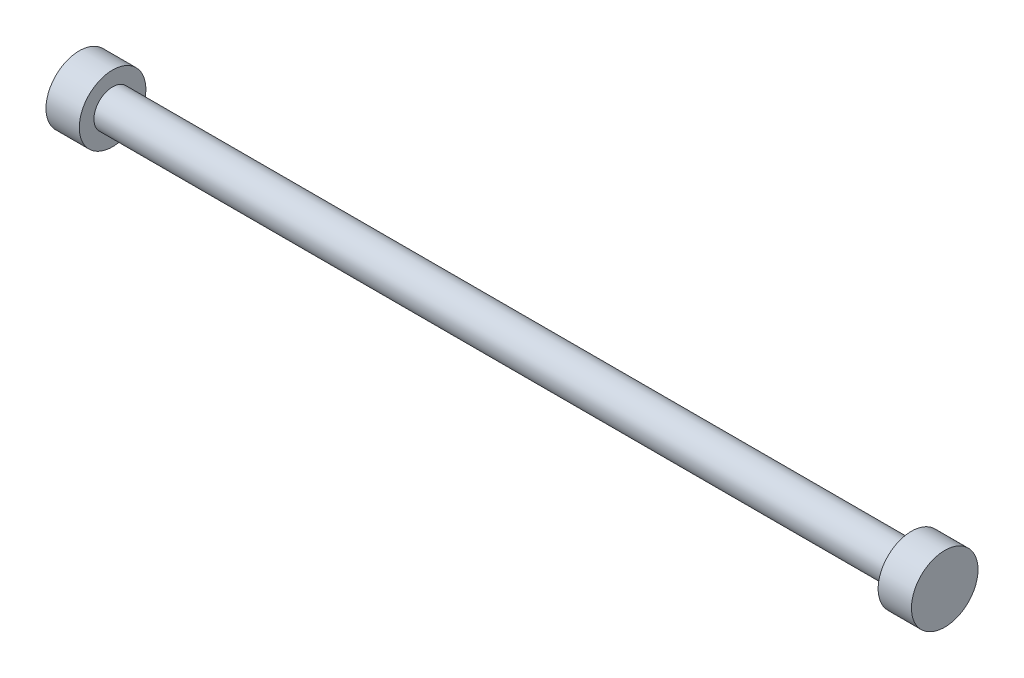
from build123d import *

# Parameters (mm, degrees)
SKETCH1_R           = 1.778
BOSS_EXTRUDE1_DEPTH = 76.2
SKETCH2_R           = 3.175
BOSS_EXTRUDE2_DEPTH = 3.175
BOSS_EXTRUDE3_START = 3.175
SKETCH3_R           = 3.175
BOSS_EXTRUDE3_DEPTH = 3.175


with BuildPart() as part:
    # Sketch1 → Boss-Extrude1 (new body)
    with BuildSketch(Plane(origin=(0, 0, 0), x_dir=(0, 0, -1), z_dir=(1, 0, 0))):
        with Locations(Location((0, 0, 0), (0, 0, 180))):
            Circle(SKETCH1_R)
    extrude(amount=BOSS_EXTRUDE1_DEPTH)

    # Sketch2 → Boss-Extrude2 (add)
    with BuildSketch(Plane.ZY):
        Circle(SKETCH2_R)
    extrude(amount=BOSS_EXTRUDE2_DEPTH)

    # Sketch3 → Boss-Extrude3 (add)
    with BuildSketch(Plane(origin=(76.2, 0, 0), x_dir=(0, 0, -1), z_dir=(1, 0, 0)).offset(BOSS_EXTRUDE3_START)):
        with Locations(Location((0, 0, 0), (0, 0, 180))):
            Circle(SKETCH3_R)
    extrude(amount=-BOSS_EXTRUDE3_DEPTH)


solid = part.part
